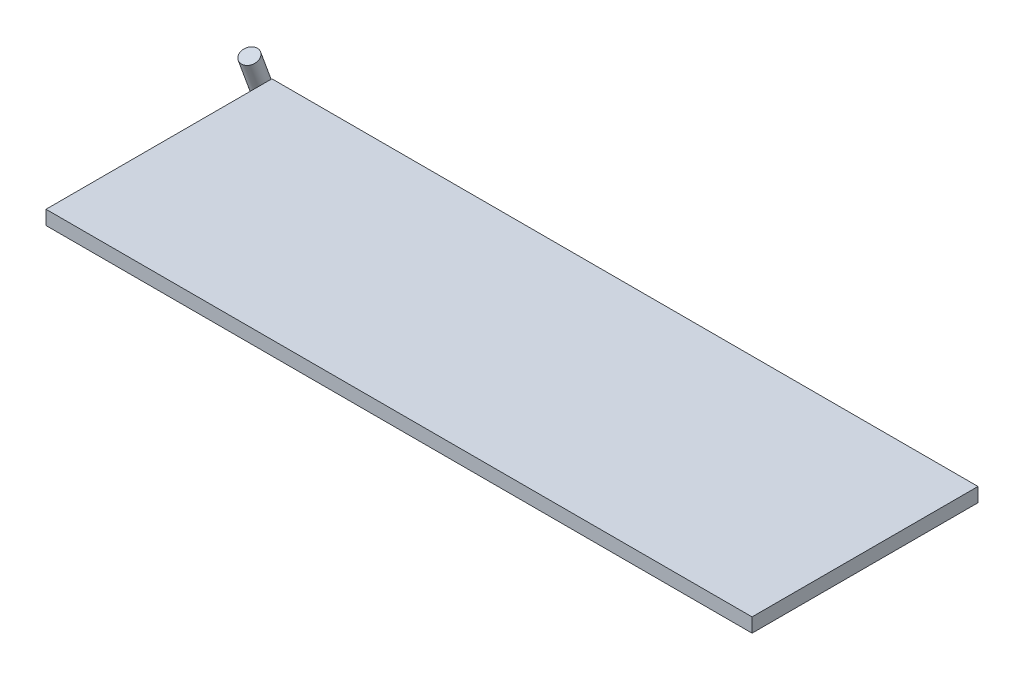
from build123d import *

# Parameters (mm, degrees)
SKETCH1_W           = 250
SKETCH1_H           = 80
BOSS_EXTRUDE1_DEPTH = 5
SKETCH4_R           = 3
BOSS_EXTRUDE3_DEPTH = 13


with BuildPart() as part:
    # Sketch1 → Boss-Extrude1 (new body)
    with BuildSketch(Plane(origin=(0, 0, 0), x_dir=(1, 0, 0), z_dir=(0, 1, 0))):
        with Locations((-100, 33.659007121)):
            Rectangle(SKETCH1_W, SKETCH1_H)
    extrude(amount=BOSS_EXTRUDE1_DEPTH)


with BuildPart() as body_2:
    # Sketch4 → Boss-Extrude3 (new body)
    with BuildSketch(Plane(origin=(0, -23.673548559, -8.616467015), x_dir=(-1, 0, 0), z_dir=(0, -0.9396926207859081, -0.34202014332566943))):
        with Locations(Location((228.679664398, 69.368659621, 0), (0, 0, 90))):
            Circle(SKETCH4_R)
    extrude(amount=-BOSS_EXTRUDE3_DEPTH)


solid = Compound([part.part, body_2.part])
